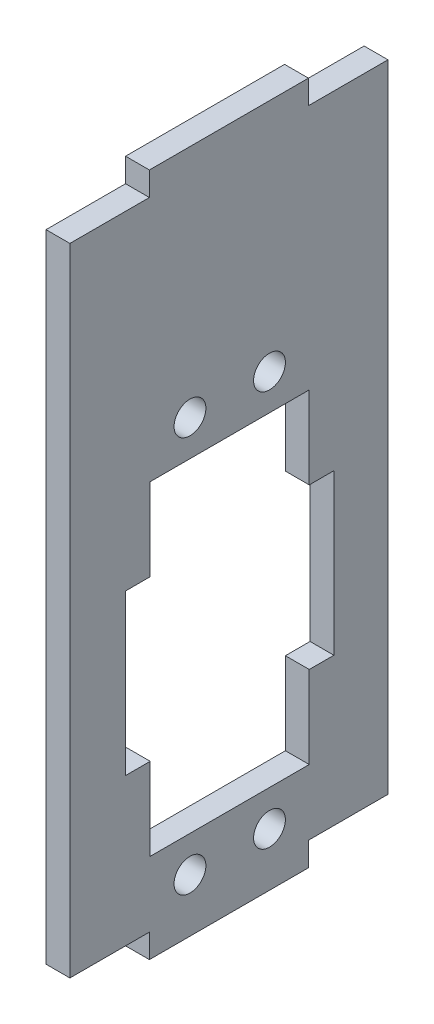
from build123d import *

# Parameters (mm, degrees)
BOSS_EXTRU_1_DEPTH      = 3
ESQUISSE2_R             = 2
ENL_V_MAT_EXTRU_1_DEPTH = 99.4971691


with BuildPart() as part:
    # Esquisse1 → Boss.-Extru.1 (new body)
    with BuildSketch(Plane(origin=(3, 0, 0), x_dir=(0, 0, -1), z_dir=(1, 0, 0))):
        Polygon((-31.50377455, 89.275579073), (-31.50377455, 86.275579073), (-41.50377455, 86.275579073), (-41.50377455, 6.275579073), (-31.50377455, 6.275579073), (-31.50377455, 3.275579073), (-11.50377455, 3.275579073), (-11.50377455, 6.275579073), (-1.50377455, 6.275579073), (-1.50377455, 86.275579073), (-11.50377455, 86.275579073), (-11.50377455, 89.275579073), align=None)
    extrude(amount=-BOSS_EXTRU_1_DEPTH)

    # Esquisse2 → Enlèv. mat.-Extru.1 (cut, through all)
    with BuildSketch(Plane.ZY):
        with Locations(Location((26.40377455, 9.975579073, 0), (0, 0, 180))):
            Circle(ESQUISSE2_R)
        with Locations(Location((16.40377455, 59.775579073, 0), (0, 0, 180))):
            Circle(ESQUISSE2_R)
        with Locations(Location((26.40377455, 59.775579073, 0), (0, 0, 180))):
            Circle(ESQUISSE2_R)
        with Locations(Location((16.40377455, 9.975579073, 0), (0, 0, 180))):
            Circle(ESQUISSE2_R)
        Polygon((11.40377455, 44.925579073), (11.40377455, 55.275579073), (31.40377455, 55.275579073), (31.40377455, 44.925579073), (34.50377455, 44.925579073), (34.50377455, 24.825579073), (31.40377455, 24.825579073), (31.40377455, 14.475579073), (11.40377455, 14.475579073), (11.40377455, 24.825579073), (8.30377455, 24.825579073), (8.30377455, 44.925579073), align=None)
    extrude(amount=-ENL_V_MAT_EXTRU_1_DEPTH, mode=Mode.SUBTRACT)


solid = part.part
